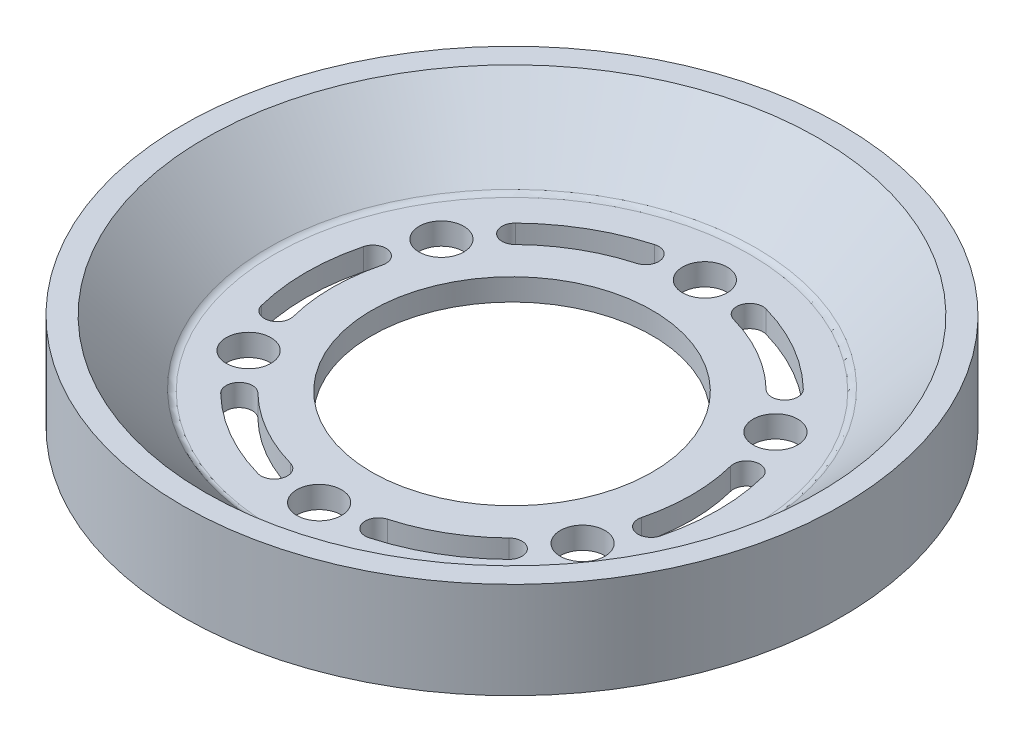
from build123d import *

# Parameters (mm, degrees)
SKETCH1_R           = 37.595
BOSS_EXTRUDE1_DEPTH = 5.5
SKETCH3_R           = 16
SKETCH3_R_2         = 2.55
CUT_EXTRUDE1_DEPTH  = 11
FILLET1_R           = 1
CUT_EXTRUDE2_DEPTH  = 10
CIRPATTERN1_COUNT   = 6


with BuildPart() as part:
    # Sketch1 → Boss-Extrude1 (new, symmetric)
    with BuildSketch(Plane(origin=(0, 0, 0), x_dir=(1, 0, 0), z_dir=(0, 1, 0))):
        Circle(SKETCH1_R)
    extrude(amount=BOSS_EXTRUDE1_DEPTH, both=True)

    # Sketch2 → Cut-Revolve1 (revolve, cut)
    with BuildSketch(Plane(origin=(0, 0, 0), x_dir=(0, 0, -1), z_dir=(1, 0, 0))):
        Polygon((0, 5.5), (0, -2), (-27.5, -2), (-35, 5.5), align=None)
        Polygon((0, -5.5), (0, -4.5), (-27.5, -4.5), (-30.75, -1.25), (-35, -5.5), align=None)
    revolve(axis=Axis((0, 19.347580659, 0), (0, -1, 0)), mode=Mode.SUBTRACT)

    # Sketch3 → Cut-Extrude1 (cut)
    with BuildSketch(Plane(origin=(0, -2, 0), x_dir=(1, 0, 0), z_dir=(0, 1, 0))):
        Circle(SKETCH3_R)
        with Locations((0, 22)):
            Circle(SKETCH3_R_2)
        with Locations((19.052558883, 11)):
            Circle(SKETCH3_R_2)
        with Locations((19.052558883, -11)):
            Circle(SKETCH3_R_2)
        with Locations((0, -22)):
            Circle(SKETCH3_R_2)
        with Locations((-19.052558883, -11)):
            Circle(SKETCH3_R_2)
        with Locations((-19.052558883, 11)):
            Circle(SKETCH3_R_2)
    extrude(amount=-CUT_EXTRUDE1_DEPTH, mode=Mode.SUBTRACT)

    # Fillet1
    fillet1_edges = [part.edges().sort_by_distance(p)[0] for p in [
        (0, -1.25, -30.75),
        (0, -2, -27.5),
    ]]
    fillet(fillet1_edges, radius=FILLET1_R)

    # Sketch4 → Cut-Extrude2 (cut)
    with BuildSketch(Plane(origin=(0, -2, 0), x_dir=(1, 0, 0), z_dir=(0, 1, 0))):
        with BuildLine():
            ThreePointArc((-16.420108098, 16.811604625), (-16.445097238, 14.690431472), (-14.323924085, 14.665442332))
            ThreePointArc((-14.323924085, 14.665442332), (-10.25, 17.753520778), (-5.538683575, 19.737603306))
            ThreePointArc((-5.538683575, 19.737603306), (-4.499738229, 21.587087712), (-6.349222635, 22.626033058))
            ThreePointArc((-6.349222635, 22.626033058), (-11.75, 20.351596989), (-16.420108098, 16.811604625))
        make_face()
    cut_extrude2 = extrude(amount=-CUT_EXTRUDE2_DEPTH, mode=Mode.SUBTRACT)

    # CirPattern1: Cut-Extrude2 ×6 about axis
    cirpattern1_axis = Axis((0, -2, 0), (0, 1, 0))
    for i in range(1, CIRPATTERN1_COUNT):
        add(cut_extrude2.rotate(cirpattern1_axis, i * 360 / CIRPATTERN1_COUNT), mode=Mode.SUBTRACT)


solid = part.part
